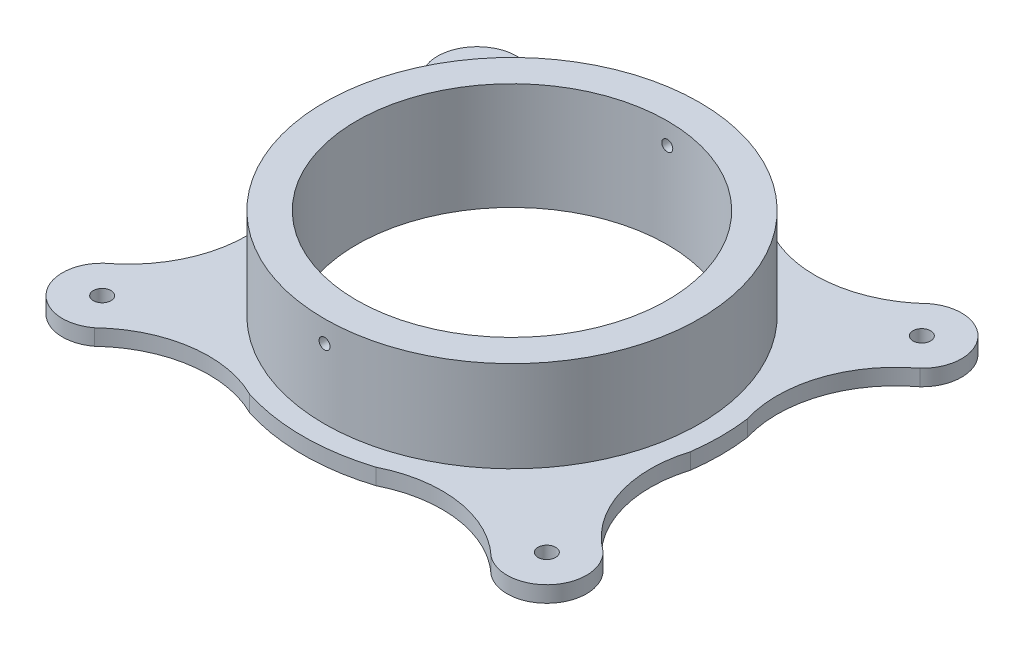
from build123d import *

# Parameters (mm, degrees)
EXTRUDE_2_DEPTH     = 3
SKETCH_2_R          = 35
EXTRUDE_3_DEPTH     = 17
SKETCH_10_W         = 1.025
SKETCH_10_H         = 42.416288383
HOLE_WIZARD_M4_2_D  = 3.3
HOLE_WIZARD_M64_1_D = 58


with BuildPart() as part:
    # 草图1 → 凸台-拉伸2 (new body)
    with BuildSketch(Plane(origin=(0, 0, 0), x_dir=(1, 0, 0), z_dir=(0, 1, 0))):
        with BuildLine():
            ThreePointArc((37.022422142, 40.912074924), (47.169257948, 39.781301884), (46.571881267, 29.589144819))
            ThreePointArc((46.571881267, 29.589144819), (38.766254834, 18.72698333), (38.631055592, 5.351779505))
            ThreePointArc((38.631055592, 5.351779505), (39, 0), (38.631055592, -5.351779505))
            ThreePointArc((38.631055592, -5.351779505), (38.766254834, -18.72698333), (46.571881267, -29.589144819))
            ThreePointArc((46.571881267, -29.589144819), (47.169257948, -39.781301884), (37.022422142, -40.912074924))
            ThreePointArc((37.022422142, -40.912074924), (24.999035301, -35.050972205), (11.792759981, -37.174330014))
            ThreePointArc((11.792759981, -37.174330014), (0, -39), (-11.792759981, -37.174330014))
            ThreePointArc((-11.792759981, -37.174330014), (-24.999035301, -35.050972205), (-37.022422142, -40.912074924))
            ThreePointArc((-37.022422142, -40.912074924), (-47.169257948, -39.781301884), (-46.571881267, -29.589144819))
            ThreePointArc((-46.571881267, -29.589144819), (-38.766254834, -18.72698333), (-38.631055592, -5.351779505))
            ThreePointArc((-38.631055592, -5.351779505), (-39, 0), (-38.631055592, 5.351779505))
            ThreePointArc((-38.631055592, 5.351779505), (-38.766254834, 18.72698333), (-46.571881267, 29.589144819))
            ThreePointArc((-46.571881267, 29.589144819), (-47.169257948, 39.781301884), (-37.022422142, 40.912074924))
            ThreePointArc((-37.022422142, 40.912074924), (-24.999035301, 35.050972205), (-11.792759981, 37.174330014))
            ThreePointArc((-11.792759981, 37.174330014), (0, 39), (11.792759981, 37.174330014))
            ThreePointArc((11.792759981, 37.174330014), (24.999035301, 35.050972205), (37.022422142, 40.912074924))
        make_face()
    extrude(amount=EXTRUDE_2_DEPTH)

    # 草图2 → 凸台-拉伸3 (add)
    with BuildSketch(Plane(origin=(0, 3, 0), x_dir=(1, 0, 0), z_dir=(0, 1, 0))):
        with Locations(Location((0, 0, 0), (0, 0, 270))):
            Circle(SKETCH_2_R)
    extrude(amount=EXTRUDE_3_DEPTH)

    # 草图10 → M2.5 螺纹孔1 (revolve, cut)
    with BuildSketch(Plane(origin=(0, 16, 0), x_dir=(0, 1, 0), z_dir=(1, 0, 0))):
        with Locations((0.5125, 21.208144192)):
            Rectangle(SKETCH_10_W, SKETCH_10_H)
    hole_wizard_m2_5_1 = revolve(axis=Axis((0, 16, -6.35), (0, 0, 1)), mode=Mode.SUBTRACT)

    # 镜向3: M2.5 螺纹孔1 across plane
    add(hole_wizard_m2_5_1.mirror(Plane.XY), mode=Mode.SUBTRACT)

    # M4 螺纹孔2 (through all)
    with Locations(Plane(origin=(0, 20, 0), x_dir=(1, 0, 0), z_dir=(0, 1, 0))):
        with Locations((-41.5, 35), (-41.5, -35), (41.5, -35), (41.5, 35)):
            Hole(HOLE_WIZARD_M4_2_D / 2)

    # M64 螺纹孔1 (through all)
    with Locations(Plane(origin=(0, 20, 0), x_dir=(1, 0, 0), z_dir=(0, 1, 0))):
        with Locations((0, 0)):
            Hole(HOLE_WIZARD_M64_1_D / 2)


solid = part.part
